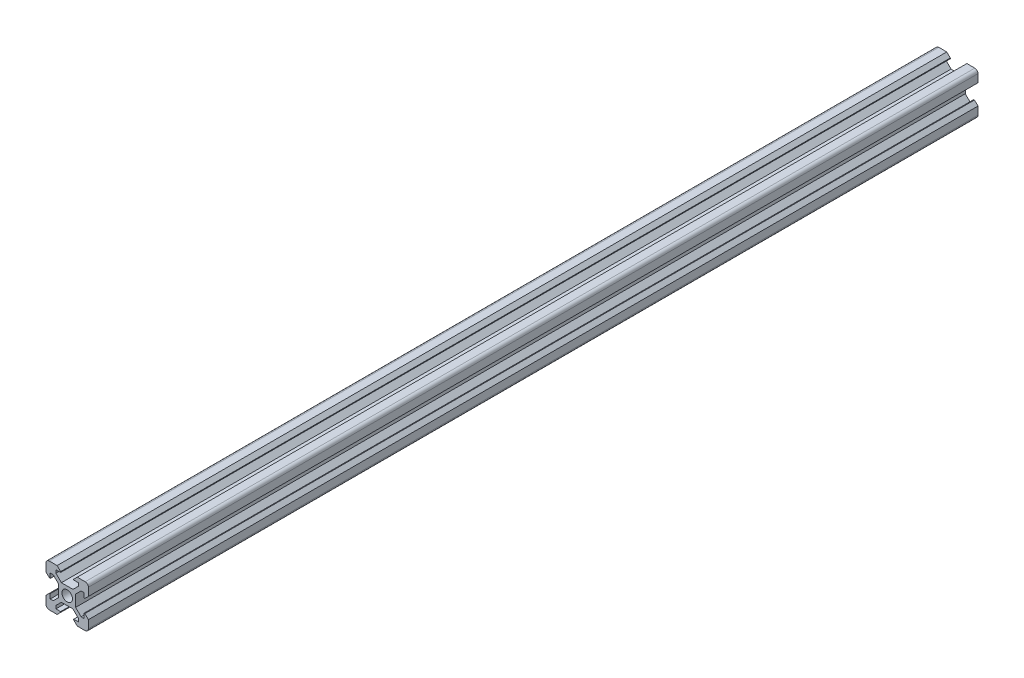
from build123d import *

# Parameters (mm, degrees)
SKETCH2_R           = 2.5
BOSS_EXTRUDE1_DEPTH = 420


with BuildPart() as part:
    # Sketch2 → Boss-Extrude1 (new body)
    with BuildSketch(Plane.XY):
        with BuildLine():
            Line((-4, -2.727207794), (-4, 2.727207794))
            Line((-4, 2.727207794), (-6.572792206, 5.3))
            Line((-6.572792206, 5.3), (-8, 5.3))
            Line((-8, 5.3), (-8, 3.1))
            Line((-8, 3.1), (-8.35, 3.1))
            Line((-8.35, 3.1), (-10, 4.75))
            Line((-10, 4.75), (-10, 8.5))
            ThreePointArc((-10, 8.5), (-9.560660172, 9.560660172), (-8.5, 10))
            Line((-8.5, 10), (-4.75, 10))
            Line((-4.75, 10), (-3.1, 8.35))
            Line((-3.1, 8.35), (-3.1, 8))
            Line((-3.1, 8), (-5.3, 8))
            Line((-5.3, 8), (-5.3, 6.572792206))
            Line((-5.3, 6.572792206), (-2.727207794, 4))
            Line((-2.727207794, 4), (2.727207794, 4))
            Line((2.727207794, 4), (5.3, 6.572792206))
            Line((5.3, 6.572792206), (5.3, 8))
            Line((5.3, 8), (3.1, 8))
            Line((3.1, 8), (3.1, 8.35))
            Line((3.1, 8.35), (4.75, 10))
            Line((4.75, 10), (8.5, 10))
            ThreePointArc((8.5, 10), (9.560660172, 9.560660172), (10, 8.5))
            Line((10, 8.5), (10, 4.75))
            Line((10, 4.75), (8.35, 3.1))
            Line((8.35, 3.1), (8, 3.1))
            Line((8, 3.1), (8, 5.3))
            Line((8, 5.3), (6.572792206, 5.3))
            Line((6.572792206, 5.3), (4, 2.727207794))
            Line((4, 2.727207794), (4, -2.727207794))
            Line((4, -2.727207794), (6.572792206, -5.3))
            Line((6.572792206, -5.3), (8, -5.3))
            Line((8, -5.3), (8, -3.1))
            Line((8, -3.1), (8.35, -3.1))
            Line((8.35, -3.1), (10, -4.75))
            Line((10, -4.75), (10, -8.5))
            ThreePointArc((10, -8.5), (9.560660172, -9.560660172), (8.5, -10))
            Line((8.5, -10), (4.75, -10))
            Line((4.75, -10), (3.1, -8.35))
            Line((3.1, -8.35), (3.1, -8))
            Line((3.1, -8), (5.3, -8))
            Line((5.3, -8), (5.3, -6.572792206))
            Line((5.3, -6.572792206), (2.727207794, -4))
            Line((2.727207794, -4), (-2.727207794, -4))
            Line((-2.727207794, -4), (-5.3, -6.572792206))
            Line((-5.3, -6.572792206), (-5.3, -8))
            Line((-5.3, -8), (-3.1, -8))
            Line((-3.1, -8), (-3.1, -8.35))
            Line((-3.1, -8.35), (-4.75, -10))
            Line((-4.75, -10), (-8.5, -10))
            ThreePointArc((-8.5, -10), (-9.560660172, -9.560660172), (-10, -8.5))
            Line((-10, -8.5), (-10, -4.75))
            Line((-10, -4.75), (-8.35, -3.1))
            Line((-8.35, -3.1), (-8, -3.1))
            Line((-8, -3.1), (-8, -5.3))
            Line((-8, -5.3), (-6.572792206, -5.3))
            Line((-6.572792206, -5.3), (-4, -2.727207794))
        make_face()
        Circle(SKETCH2_R, mode=Mode.SUBTRACT)
    extrude(amount=BOSS_EXTRUDE1_DEPTH)


solid = part.part
